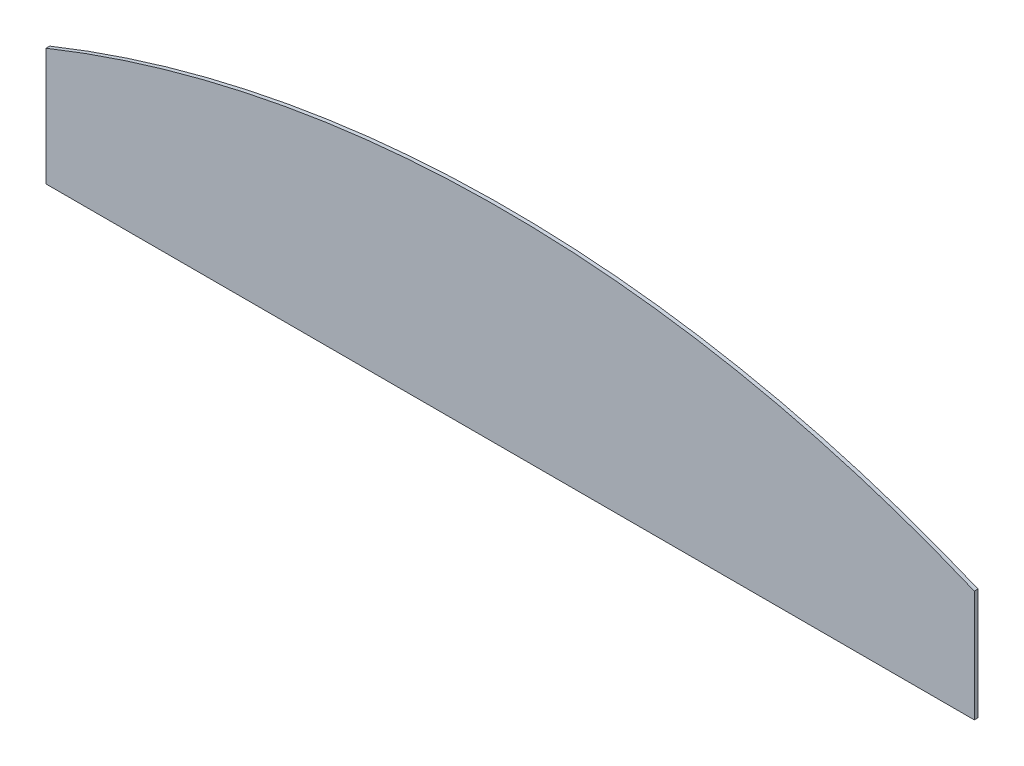
from build123d import *

# Parameters (mm, degrees)
BOSS_EXTRUDE1_DEPTH = 1.5


with BuildPart() as part:
    # Sketch1 → Boss-Extrude1 (new body)
    with BuildSketch(Plane.XY):
        with BuildLine():
            Line((-187.007874016, 415.580621179), (192.992125984, 415.580621179))
            Line((192.992125984, 415.580621179), (192.992125984, 461.252684879))
            ThreePointArc((192.992125984, 461.252684879), (3.234789477, 499.989536028), (-187.007874016, 463.711176333))
            Line((-187.007874016, 463.711176333), (-187.007874016, 415.580621179))
        make_face()
    extrude(amount=BOSS_EXTRUDE1_DEPTH)


solid = part.part
